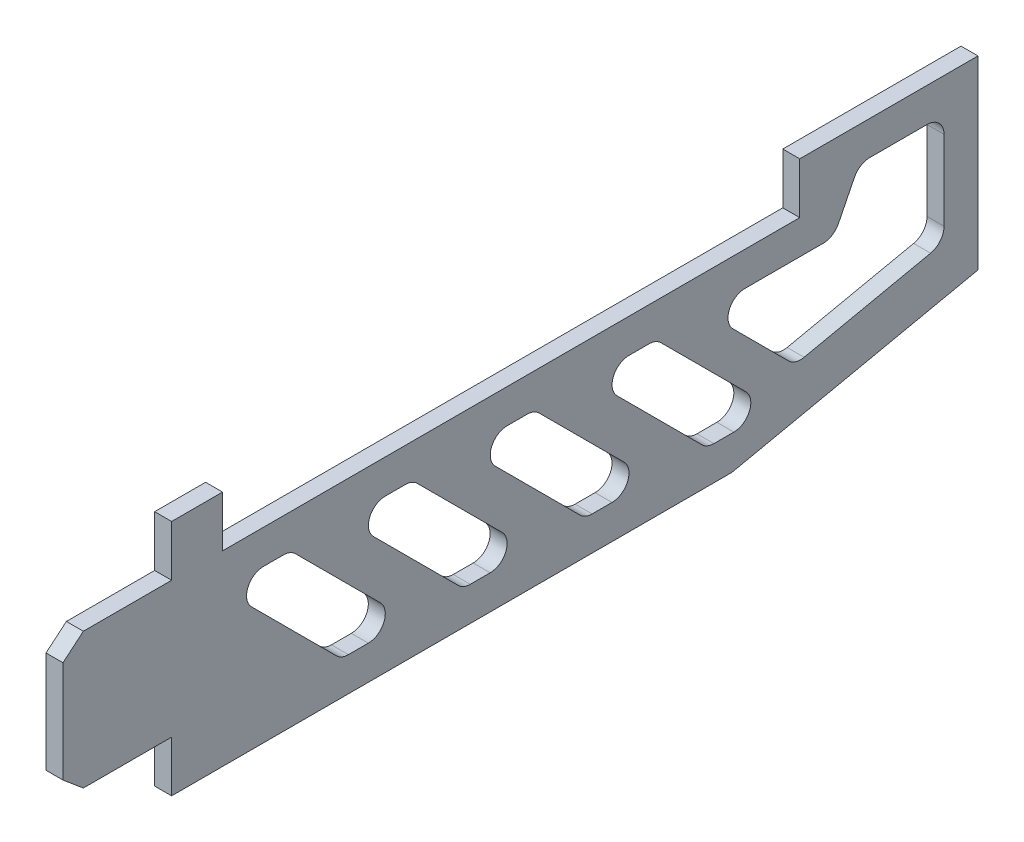
from build123d import *

# Parameters (mm, degrees)
SKIZZE1_W                       = 237.5
SKIZZE1_H                       = 70
AUFSATZ_LINEAR_AUSTRAGEN1_DEPTH = 5
SCHNITT_LINEAR_AUSTRAGEN1_DEPTH = 248.651468802
SKIZZE3_W                       = 170
SKIZZE3_H                       = 15
SCHNITT_LINEAR_AUSTRAGEN2_DEPTH = 5
SCHNITT_LINEAR_AUSTRAGEN3_DEPTH = 248.651468802
VERRUNDUNG1_R                   = 5
LASCHENASE_DEPTH                = 5


with BuildPart() as part:
    # Skizze1 → Aufsatz-Linear austragen1 (new body)
    with BuildSketch(Plane(origin=(0, 0, 0), x_dir=(0, 0, -1), z_dir=(1, 0, 0))):
        with Locations((118.75, 35)):
            Rectangle(SKIZZE1_W, SKIZZE1_H)
    extrude(amount=AUFSATZ_LINEAR_AUSTRAGEN1_DEPTH)

    # Skizze2 → Schnitt-Linear austragen1 (cut, through all)
    with BuildSketch(Plane(origin=(5, 0, 0), x_dir=(0, 0, -1), z_dir=(1, 0, 0))):
        Polygon((165, 0), (237.5, 15.410350721), (237.5, 0), align=None)
    extrude(amount=-SCHNITT_LINEAR_AUSTRAGEN1_DEPTH, mode=Mode.SUBTRACT)

    # Skizze3 → Schnitt-Linear austragen2 (cut)
    with BuildSketch(Plane(origin=(5, 0, 0), x_dir=(0, 0, -1), z_dir=(1, 0, 0))):
        with Locations((100, 62.5)):
            Rectangle(SKIZZE3_W, SKIZZE3_H)
    extrude(amount=-SCHNITT_LINEAR_AUSTRAGEN2_DEPTH, mode=Mode.SUBTRACT)

    # Skizze4 → Schnitt-Linear austragen3 (cut, through all)
    with BuildSketch(Plane(origin=(5, 0, 0), x_dir=(0, 0, -1), z_dir=(1, 0, 0))):
        Polygon((15, 45), (50, 10), (70, 10), (35, 45), align=None)
        Polygon((50.884510848, 45), (70.884510848, 45), (105.884510848, 10), (85.884510848, 10), align=None)
        Polygon((86.769021696, 45), (106.769021696, 45), (141.769021696, 10), (121.769021696, 10), align=None)
        Polygon((122.653532545, 45), (142.653532545, 45), (177.653532545, 10), (157.653532545, 10), align=None)
        Polygon((227.5, 60), (227.5, 27.5), (183.622185543, 18.173482625), (156.795668168, 45), (195, 45), (202.5, 60), align=None)
    extrude(amount=-SCHNITT_LINEAR_AUSTRAGEN3_DEPTH, mode=Mode.SUBTRACT)

    # Verrundung1
    verrundung1_edges = [part.edges().sort_by_distance(p)[0] for p in [
        (2.5, 60, -202.5),
        (2.5, 60, -227.5),
        (2.5, 27.5, -227.5),
        (2.5, 18.173482625, -183.622185543),
        (2.5, 45, -156.795668168),
        (2.5, 45, -195),
        (2.5, 10, -85.884510848),
        (2.5, 45, -50.884510848),
        (2.5, 45, -70.884510848),
        (2.5, 10, -105.884510848),
        (2.5, 10, -157.653532545),
        (2.5, 45, -122.653532545),
        (2.5, 45, -142.653532545),
        (2.5, 10, -177.653532545),
        (2.5, 10, -121.769021696),
        (2.5, 45, -86.769021696),
        (2.5, 45, -106.769021696),
        (2.5, 10, -141.769021696),
        (2.5, 45, -15),
        (2.5, 45, -35),
        (2.5, 10, -70),
        (2.5, 10, -50),
    ]]
    fillet(verrundung1_edges, radius=VERRUNDUNG1_R)

    # Skizze5 → LascheNase (add)
    with BuildSketch(Plane(origin=(5, 0, 0), x_dir=(0, 0, -1), z_dir=(1, 0, 0))):
        Polygon((0, 55), (-26, 55), (-32, 49.965402213), (-32, 20.034597787), (-26, 15), (0, 15), align=None)
    extrude(amount=-LASCHENASE_DEPTH)


solid = part.part
